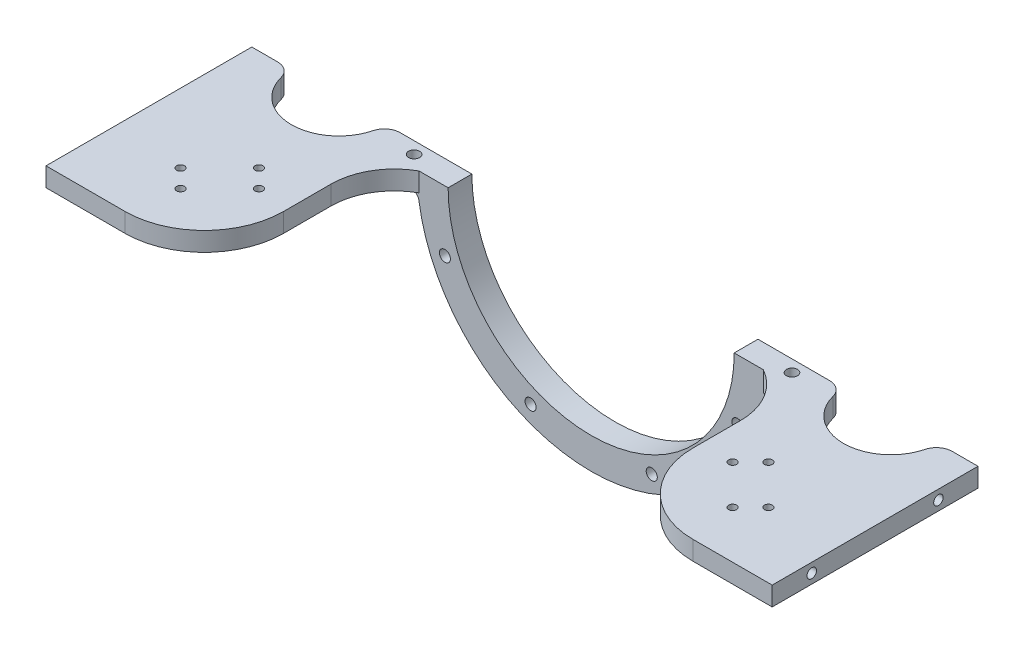
from build123d import *

# Parameters (mm, degrees)
SKETCH_1_R          = 3.5
EXTRUDE_1_DEPTH     = 15
EXTRUDE_START       = -15
EXTRUDE_2_DEPTH     = 15
CUT_EXTRUDE_1_REACH = 164.969
SKETCH_3_R          = 3.5
EXTRUDE_3_DEPTH     = 12
CUT_EXTRUDE_2_REACH = 287.654
SKETCH_7_R          = 2.5
SKETCH_8_R          = 3
CUT_EXTRUDE_3_DEPTH = 30
CUT_EXTRUDE_4_DEPTH = 4.5
FILLET_1_R          = 5
FILLET_4_R          = 5
FILLET_5_R          = 50
FILLET_6_R          = 50
CUT_EXTRUDE_5_REACH = 287.654
FILLET_7_R          = 10
FILLET_8_R          = 10
FILLET_9_R          = 10
FILLET_10_R         = 10


with BuildPart() as part:
    # 草图1 → 凸台-拉伸1 (new body)
    with BuildSketch(Plane.XY):
        with BuildLine():
            Line((-110, 0), (-90.35, 0))
            ThreePointArc((-90.35, 0), (0, -90.35), (90.35, 0))
            Line((90.35, 0), (110, 0))
            ThreePointArc((110, 0), (0, -110), (-110, 0))
        make_face()
        with Locations((38.268343237, -92.387953251)):
            Circle(SKETCH_1_R, mode=Mode.SUBTRACT)
        with Locations((-38.268343237, -92.387953251)):
            Circle(SKETCH_1_R, mode=Mode.SUBTRACT)
        with Locations((-92.387953251, -38.268343237)):
            Circle(SKETCH_1_R, mode=Mode.SUBTRACT)
        with Locations((92.387953251, -38.268343237)):
            Circle(SKETCH_1_R, mode=Mode.SUBTRACT)
    extrude(amount=EXTRUDE_1_DEPTH)

    # 草图2 → 凸台-拉伸2 (add)
    with BuildSketch(Plane.XY.offset(15).offset(EXTRUDE_START)):
        with BuildLine():
            Line((-110, 0), (-129.343495463, 0))
            Line((-129.343495463, 0), (-129.343495463, -12))
            Line((-129.343495463, -12), (-109.343495463, -12))
            ThreePointArc((-109.343495463, -12), (-109.83575124, -6.008972421), (-110, 0))
        make_face()
    extrude_2 = extrude(amount=EXTRUDE_2_DEPTH)

    # 草图3 → 切除-拉伸1 (cut, up to next)
    with BuildSketch(Plane.XZ.offset(12), mode=Mode.PRIVATE) as cut_extrude_1_sk1:
        with Locations((-119.343495463, 7.5)):
            Circle(SKETCH_3_R)
    cut_extrude_1_tool1 = extrude(cut_extrude_1_sk1.sketch, amount=-CUT_EXTRUDE_1_REACH, mode=Mode.PRIVATE) & part.part
    cut_extrude_1 = cut_extrude_1_tool1.solids().sort_by_distance((-119.343495, -12, 7.5))[0]
    add(cut_extrude_1, mode=Mode.SUBTRACT)

    # 镜向1: 凸台-拉伸2, 切除-拉伸1 across plane
    add(extrude_2.mirror(Plane(origin=(0, 0, 0), x_dir=(0, 0, 1), z_dir=(1, 0, 0))))
    add(cut_extrude_1.mirror(Plane(origin=(0, 0, 0), x_dir=(0, 0, 1), z_dir=(1, 0, 0))), mode=Mode.SUBTRACT)

    # 草图4 → 凸台-拉伸3 (add)
    with BuildSketch(Plane(origin=(0, 0, 0), x_dir=(1, 0, 0), z_dir=(0, 1, 0))):
        with BuildLine():
            Line((-129.343495463, 0), (-229.343495463, 0))
            Line((-229.343495463, 0), (-229.343495463, -130))
            Line((-229.343495463, -130), (-129.343495463, -130))
            Line((-129.343495463, -130), (-129.343495463, -50))
            ThreePointArc((-129.343495463, -50), (-123.80069115, -29.684939937), (-108.708412194, -15))
            Line((-108.708412194, -15), (-129.343495463, -15))
            Line((-129.343495463, -15), (-129.343495463, 0))
        make_face()
    extrude_3 = extrude(amount=-EXTRUDE_3_DEPTH)

    # 草图7 → 切除-拉伸2 (cut, up to next)
    with BuildSketch(Plane(origin=(0, 0, 0), x_dir=(1, 0, 0), z_dir=(0, 1, 0)), mode=Mode.PRIVATE) as cut_extrude_2_sk1:
        with Locations(Location((-185.657203962, -88.686291501, 0), (0, 0, 270))):
            Circle(SKETCH_7_R)
    cut_extrude_2_tool1 = extrude(cut_extrude_2_sk1.sketch, amount=-CUT_EXTRUDE_2_REACH, mode=Mode.PRIVATE) & part.part
    # 草图7 → 切除-拉伸2 (cut, up to next)
    with BuildSketch(Plane(origin=(0, 0, 0), x_dir=(1, 0, 0), z_dir=(0, 1, 0)), mode=Mode.PRIVATE) as cut_extrude_2_sk2:
        with Locations(Location((-174.343495463, -100, 0), (0, 0, 270))):
            Circle(SKETCH_7_R)
    cut_extrude_2_tool2 = extrude(cut_extrude_2_sk2.sketch, amount=-CUT_EXTRUDE_2_REACH, mode=Mode.PRIVATE) & part.part
    # 草图7 → 切除-拉伸2 (cut, up to next)
    with BuildSketch(Plane(origin=(0, 0, 0), x_dir=(1, 0, 0), z_dir=(0, 1, 0)), mode=Mode.PRIVATE) as cut_extrude_2_sk3:
        with Locations(Location((-160.90846662, -63.937554159, 0), (0, 0, 270))):
            Circle(SKETCH_7_R)
    cut_extrude_2_tool3 = extrude(cut_extrude_2_sk3.sketch, amount=-CUT_EXTRUDE_2_REACH, mode=Mode.PRIVATE) & part.part
    # 草图7 → 切除-拉伸2 (cut, up to next)
    with BuildSketch(Plane(origin=(0, 0, 0), x_dir=(1, 0, 0), z_dir=(0, 1, 0)), mode=Mode.PRIVATE) as cut_extrude_2_sk4:
        with Locations(Location((-149.594758121, -75.251262658, 0), (0, 0, 270))):
            Circle(SKETCH_7_R)
    cut_extrude_2_tool4 = extrude(cut_extrude_2_sk4.sketch, amount=-CUT_EXTRUDE_2_REACH, mode=Mode.PRIVATE) & part.part
    cut_extrude_2_1 = cut_extrude_2_tool1.solids().sort_by_distance((-185.657204, 0, 88.686292))[0]
    add(cut_extrude_2_1, mode=Mode.SUBTRACT)
    cut_extrude_2_2 = cut_extrude_2_tool2.solids().sort_by_distance((-174.343495, 0, 100))[0]
    add(cut_extrude_2_2, mode=Mode.SUBTRACT)
    cut_extrude_2_3 = cut_extrude_2_tool3.solids().sort_by_distance((-160.908467, 0, 63.937554))[0]
    add(cut_extrude_2_3, mode=Mode.SUBTRACT)
    cut_extrude_2_4 = cut_extrude_2_tool4.solids().sort_by_distance((-149.594758, 0, 75.251263))[0]
    add(cut_extrude_2_4, mode=Mode.SUBTRACT)
    cut_extrude_2 = cut_extrude_2_1 + cut_extrude_2_2 + cut_extrude_2_3 + cut_extrude_2_4  # 切除-拉伸2 as one shape, for the pattern or mirror that repeats it

    # 镜向2: 凸台-拉伸3, 切除-拉伸2 across plane
    add(extrude_3.mirror(Plane(origin=(0, 0, 0), x_dir=(0, 0, 1), z_dir=(1, 0, 0))))
    add(cut_extrude_2.mirror(Plane(origin=(0, 0, 0), x_dir=(0, 0, 1), z_dir=(1, 0, 0))), mode=Mode.SUBTRACT)

    # 草图8 → 切除-拉伸3 (cut)
    with BuildSketch(Plane.ZY.offset(229.343495463)):
        with Locations((25, -6)):
            Circle(SKETCH_8_R)
        with Locations((105, -6)):
            Circle(SKETCH_8_R)
    cut_extrude_3 = extrude(amount=-CUT_EXTRUDE_3_DEPTH, mode=Mode.SUBTRACT)

    # 草图9 → 切除-拉伸4 (cut)
    with BuildSketch(Plane.ZY.offset(209.343495463)):
        Polygon((20.75, -8.085865128), (20.75, -12), (29.25, -12), (29.25, -8.263652951), (29.25, -3.546261356), (25, -1.092522712), (20.75, -3.546261356), align=None)
        Polygon((109.25, -3.546261356), (105, -1.092522712), (100.75, -3.546261356), (100.75, -8.085865128), (100.75, -12), (109.25, -12), (109.25, -8.263684809), align=None)
    cut_extrude_4 = extrude(amount=CUT_EXTRUDE_4_DEPTH, mode=Mode.SUBTRACT)

    # 圆角1
    fillet_1_edges = [part.edges().sort_by_distance(p)[0] for p in [
        (-109.343495463, -12, 7.5),
    ]]
    fillet(fillet_1_edges, radius=FILLET_1_R)

    # 圆角4
    fillet_4_edges = [part.edges().sort_by_distance(p)[0] for p in [
        (109.343495463, -12, 7.5),
    ]]
    fillet(fillet_4_edges, radius=FILLET_4_R)

    # 镜向4: 切除-拉伸3, 切除-拉伸4 across plane
    add(cut_extrude_3.mirror(Plane(origin=(0, 0, 0), x_dir=(0, 0, 1), z_dir=(1, 0, 0))), mode=Mode.SUBTRACT)
    add(cut_extrude_4.mirror(Plane(origin=(0, 0, 0), x_dir=(0, 0, 1), z_dir=(1, 0, 0))), mode=Mode.SUBTRACT)

    # 圆角5
    fillet_5_edges = [part.edges().sort_by_distance(p)[0] for p in [
        (-129.343495463, -6, 130),
    ]]
    fillet(fillet_5_edges, radius=FILLET_5_R)

    # 圆角6
    fillet_6_edges = [part.edges().sort_by_distance(p)[0] for p in [
        (129.343495463, -6, 130),
    ]]
    fillet(fillet_6_edges, radius=FILLET_6_R)

    # 草图10 → 切除-拉伸5 (cut, up to next)
    with BuildSketch(Plane(origin=(0, 0, 0), x_dir=(1, 0, 0), z_dir=(0, 1, 0)), mode=Mode.PRIVATE) as cut_extrude_5_sk1:
        with BuildLine():
            Line((-204.343495463, 0), (-144.343495463, 0))
            ThreePointArc((-144.343495463, 0), (-174.343495463, -30), (-204.343495463, 0))
        make_face()
    cut_extrude_5_tool1 = extrude(cut_extrude_5_sk1.sketch, amount=-CUT_EXTRUDE_5_REACH, mode=Mode.PRIVATE) & part.part
    cut_extrude_5 = cut_extrude_5_tool1.solids().sort_by_distance((-174.343495, 0, 12.732395))[0]
    add(cut_extrude_5, mode=Mode.SUBTRACT)

    # 圆角7
    fillet_7_edges = [part.edges().sort_by_distance(p)[0] for p in [
        (-204.343495463, -6, 0),
    ]]
    fillet(fillet_7_edges, radius=FILLET_7_R)

    # 圆角8
    fillet_8_edges = [part.edges().sort_by_distance(p)[0] for p in [
        (-144.343495463, -6, 0),
    ]]
    fillet(fillet_8_edges, radius=FILLET_8_R)

    # 镜向8: 切除-拉伸5 across plane
    add(cut_extrude_5.mirror(Plane(origin=(0, 0, 0), x_dir=(0, 0, 1), z_dir=(1, 0, 0))), mode=Mode.SUBTRACT)

    # 圆角9
    fillet_9_edges = [part.edges().sort_by_distance(p)[0] for p in [
        (204.343495463, -6, 0),
    ]]
    fillet(fillet_9_edges, radius=FILLET_9_R)

    # 圆角10
    fillet_10_edges = [part.edges().sort_by_distance(p)[0] for p in [
        (144.343495463, -6, 0),
    ]]
    fillet(fillet_10_edges, radius=FILLET_10_R)


solid = part.part
